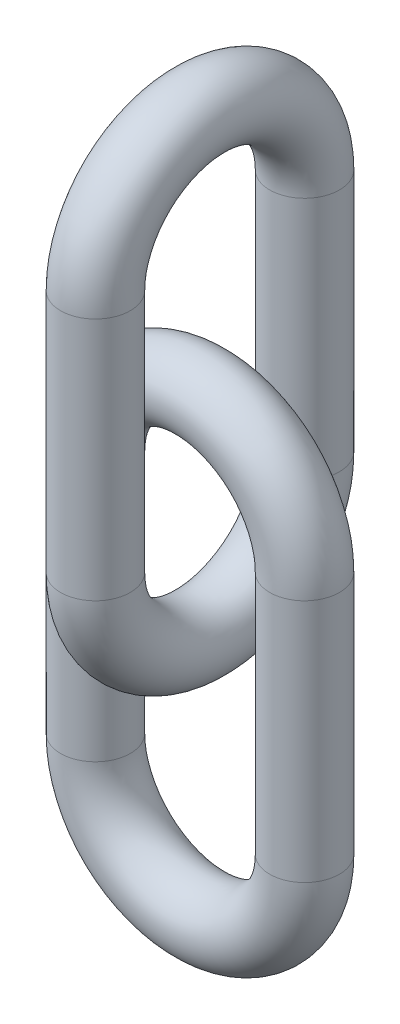
from build123d import *

# Parameters (mm, degrees)
SWEEP2_PROFILE_R = 20
SWEEP3_PROFILE_R = 20


with BuildPart() as part:
    # Sweep2: sweep along a path in Sketch2
    with BuildLine(Plane(origin=(0, 0, 0), x_dir=(0, 0, -1), z_dir=(1, 0, 0))) as sweep2_path:
        Line((0, 70), (0, -70))
        ThreePointArc((0, -70), (60, -130), (120, -70))
        Line((120, -70), (120, 70))
        ThreePointArc((120, 70), (60, 130), (0, 70))
    # Sweep2 profile (on start of the path) → Sweep2 (sweep)
    with BuildSketch(Plane(origin=(0, 70, 0), x_dir=(0, 0, -1), z_dir=(0, -1, 0))):
        Circle(SWEEP2_PROFILE_R)
    sweep(path=sweep2_path.line)


with BuildPart() as body_2:
    # Sweep3: sweep along a path in Sketch38
    with BuildLine(Plane.XY.offset(-60)) as sweep3_path:
        Line((60, -70), (60, -210))
        ThreePointArc((60, -210), (0, -270), (-60, -210))
        Line((-60, -210), (-60, -70))
        ThreePointArc((-60, -70), (0, -10), (60, -70))
    # Sweep3 profile (on start of the path) → Sweep3 (sweep)
    with BuildSketch(Plane(origin=(60, -70, -60), x_dir=(-1, 0, 0), z_dir=(0, -1, 0))):
        Circle(SWEEP3_PROFILE_R)
    sweep(path=sweep3_path.line)


solid = Compound([part.part, body_2.part])
